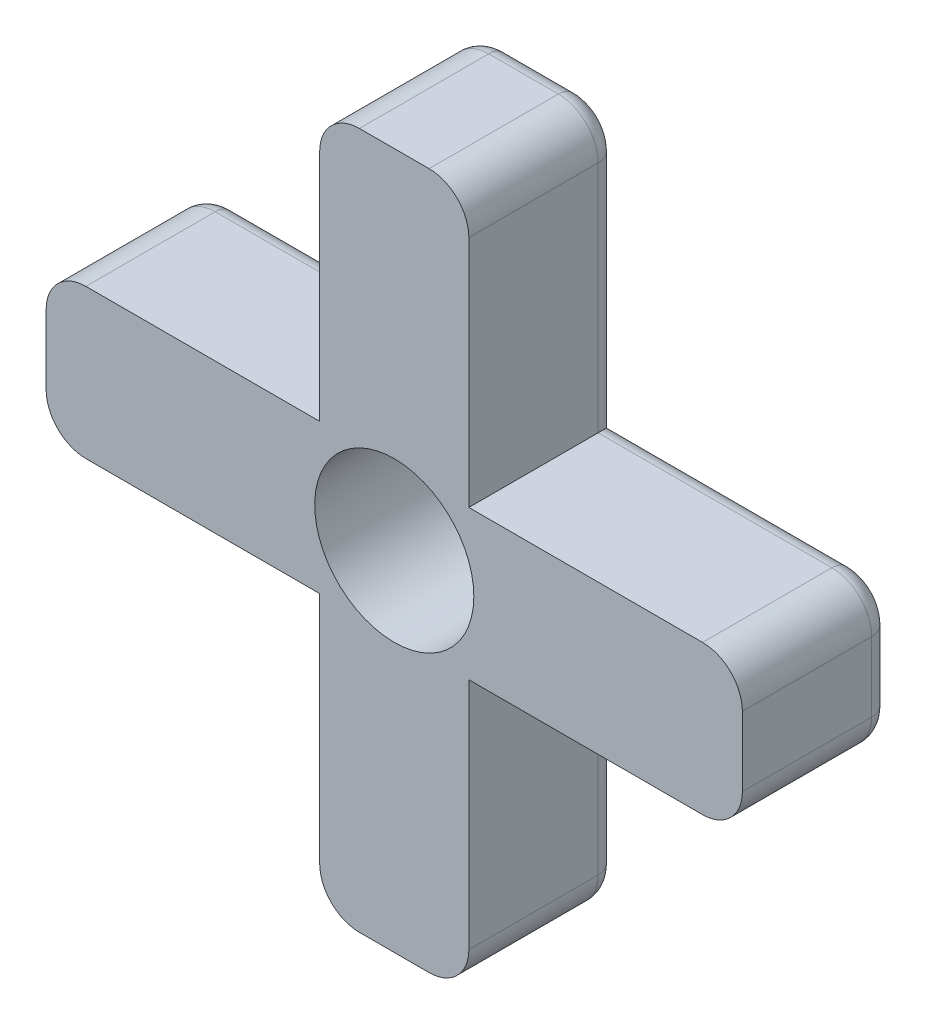
from build123d import *

# Parameters (mm, degrees)
BOSS_EXTRUDE1_DEPTH = 150
FILLET1_R           = 40
FILLET2_R           = 20
SKETCH7_R           = 80
CUT_EXTRUDE1_DEPTH  = 518.204021639


with BuildPart() as part:
    # Sketch2 → Boss-Extrude1 (new body)
    with BuildSketch(Plane.XY):
        Polygon((-75, 350), (75, 350), (75, 75), (350, 75), (350, -75), (75, -75), (75, -350), (-75, -350), (-75, -75), (-350, -75), (-350, 75), (-75, 75), align=None)
    extrude(amount=BOSS_EXTRUDE1_DEPTH)

    # Fillet1
    fillet1_edges = [part.edges().sort_by_distance(p)[0] for p in [
        (75, -350, 75),
        (-75, -350, 75),
        (-350, -75, 75),
        (-350, 75, 75),
        (-75, 350, 75),
        (75, 350, 75),
        (350, 75, 75),
        (350, -75, 75),
    ]]
    fillet(fillet1_edges, radius=FILLET1_R)

    # Fillet2
    fillet2_edges = [part.edges().sort_by_distance(p)[0] for p in [
        (-75, -192.5, 0),
        (-192.5, 75, 0),
        (75, 192.5, 0),
        (192.5, -75, 0),
        (0, 350, 0),
        (75, -192.5, 0),
        (0, -350, 0),
        (-192.5, -75, 0),
        (-350, 0, 0),
        (-75, 192.5, 0),
        (192.5, 75, 0),
        (350, 0, 0),
        (338.284271247, 63.284271247, 0),
        (338.284271247, -63.284271247, 0),
        (63.284271247, -338.284271247, 0),
        (-63.284271247, -338.284271247, 0),
        (-338.284271247, -63.284271247, 0),
        (-338.284271247, 63.284271247, 0),
        (-63.284271247, 338.284271247, 0),
        (63.284271247, 338.284271247, 0),
    ]]
    fillet(fillet2_edges, radius=FILLET2_R)

    # Sketch7 → Cut-Extrude1 (cut, through all)
    with BuildSketch(Plane.XY):
        with Locations(Location((0, 0, 0), (0, 0, 136.567463442))):
            Circle(SKETCH7_R)
    extrude(amount=CUT_EXTRUDE1_DEPTH, mode=Mode.SUBTRACT)


solid = part.part
